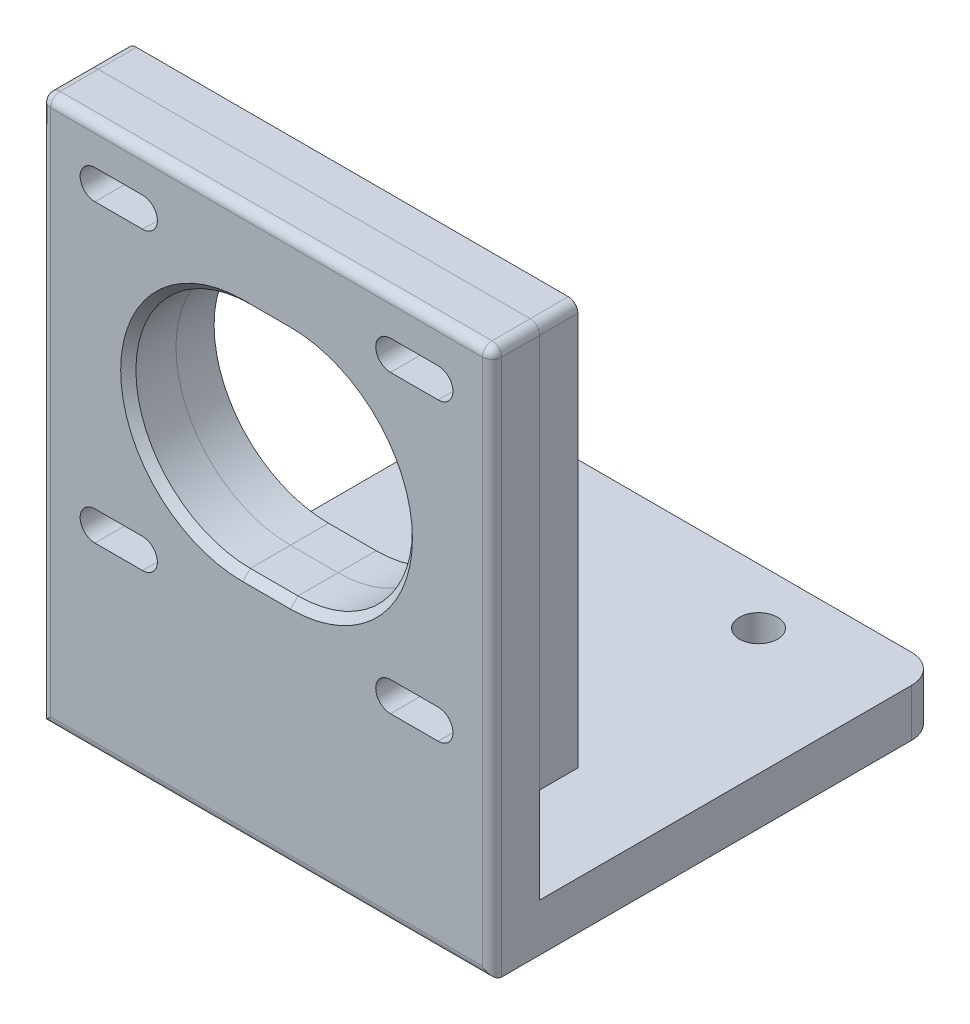
from build123d import *

# Parameters (mm, degrees)
BOSS_EXTRUDE2_DEPTH = 47.3
CUT_EXTRUDE1_REACH  = 89.918
FILLET1_R           = 1
CHAMFER1_SIZE       = 0.8
FILLET2_R           = 3
CUT_EXTRUDE2_REACH  = 84.077
SKETCH4_R           = 2
BOSS_EXTRUDE3_DEPTH = 4


with BuildPart() as part:
    # Sketch2 → Boss-Extrude2 (new body)
    with BuildSketch(Plane(origin=(0, 0, 0), x_dir=(0, 0, -1), z_dir=(1, 0, 0))):
        Polygon((0, 0), (0, -47.3), (0, -52.3), (42, -52.3), (42, -57.3), (-5, -57.3), (-5, 0), align=None)
    extrude(amount=BOSS_EXTRUDE2_DEPTH)

    # Sketch3 → Cut-Extrude1 (cut, up to next)
    with BuildSketch(Plane.XY.offset(5), mode=Mode.PRIVATE) as cut_extrude1_sk1:
        with BuildLine():
            Line((21.15, -9.15), (26.15, -9.15))
            ThreePointArc((26.15, -9.15), (38.15, -21.15), (26.15, -33.15))
            Line((26.15, -33.15), (21.15, -33.15))
            ThreePointArc((21.15, -33.15), (9.15, -21.15), (21.15, -9.15))
        make_face()
    cut_extrude1_tool1 = extrude(cut_extrude1_sk1.sketch, amount=-CUT_EXTRUDE1_REACH, mode=Mode.PRIVATE) & part.part
    # Sketch3 → Cut-Extrude1 (cut, up to next)
    with BuildSketch(Plane.XY.offset(5), mode=Mode.PRIVATE) as cut_extrude1_sk2:
        with BuildLine():
            Line((5.65, -35.1), (10.65, -35.1))
            ThreePointArc((10.65, -35.1), (12.2, -36.65), (10.65, -38.2))
            Line((10.65, -38.2), (5.65, -38.2))
            ThreePointArc((5.65, -38.2), (4.1, -36.65), (5.65, -35.1))
        make_face()
    cut_extrude1_tool2 = extrude(cut_extrude1_sk2.sketch, amount=-CUT_EXTRUDE1_REACH, mode=Mode.PRIVATE) & part.part
    # Sketch3 → Cut-Extrude1 (cut, up to next)
    with BuildSketch(Plane.XY.offset(5), mode=Mode.PRIVATE) as cut_extrude1_sk3:
        with BuildLine():
            Line((5.65, -7.2), (10.65, -7.2))
            ThreePointArc((10.65, -7.2), (12.2, -5.65), (10.65, -4.1))
            Line((10.65, -4.1), (5.65, -4.1))
            ThreePointArc((5.65, -4.1), (4.1, -5.65), (5.65, -7.2))
        make_face()
    cut_extrude1_tool3 = extrude(cut_extrude1_sk3.sketch, amount=-CUT_EXTRUDE1_REACH, mode=Mode.PRIVATE) & part.part
    # Sketch3 → Cut-Extrude1 (cut, up to next)
    with BuildSketch(Plane.XY.offset(5), mode=Mode.PRIVATE) as cut_extrude1_sk4:
        with BuildLine():
            Line((36.65, -7.2), (41.65, -7.2))
            ThreePointArc((41.65, -7.2), (43.2, -5.65), (41.65, -4.1))
            Line((41.65, -4.1), (36.65, -4.1))
            ThreePointArc((36.65, -4.1), (35.1, -5.65), (36.65, -7.2))
        make_face()
    cut_extrude1_tool4 = extrude(cut_extrude1_sk4.sketch, amount=-CUT_EXTRUDE1_REACH, mode=Mode.PRIVATE) & part.part
    # Sketch3 → Cut-Extrude1 (cut, up to next)
    with BuildSketch(Plane.XY.offset(5), mode=Mode.PRIVATE) as cut_extrude1_sk5:
        with BuildLine():
            Line((36.65, -38.2), (41.65, -38.2))
            ThreePointArc((41.65, -38.2), (43.2, -36.65), (41.65, -35.1))
            Line((41.65, -35.1), (36.65, -35.1))
            ThreePointArc((36.65, -35.1), (35.1, -36.65), (36.65, -38.2))
        make_face()
    cut_extrude1_tool5 = extrude(cut_extrude1_sk5.sketch, amount=-CUT_EXTRUDE1_REACH, mode=Mode.PRIVATE) & part.part
    add(cut_extrude1_tool1.solids().sort_by_distance((23.65, -21.15, 5))[0], mode=Mode.SUBTRACT)
    add(cut_extrude1_tool2.solids().sort_by_distance((8.15, -36.65, 5))[0], mode=Mode.SUBTRACT)
    add(cut_extrude1_tool3.solids().sort_by_distance((8.15, -5.65, 5))[0], mode=Mode.SUBTRACT)
    add(cut_extrude1_tool4.solids().sort_by_distance((39.15, -5.65, 5))[0], mode=Mode.SUBTRACT)
    add(cut_extrude1_tool5.solids().sort_by_distance((39.15, -36.65, 5))[0], mode=Mode.SUBTRACT)

    # Fillet1
    fillet1_edges = [part.edges().sort_by_distance(p)[0] for p in [
        (0, 0, 2.5),
        (23.65, -57.3, 5),
        (23.65, 0, 5),
        (47.3, 0, 2.5),
        (47.3, -28.65, 5),
        (0, -28.65, 5),
    ]]
    fillet(fillet1_edges, radius=FILLET1_R)

    # Chamfer1
    chamfer1_edges = [part.edges().sort_by_distance(p)[0] for p in [
        (9.15, -21.15, 5),
        (23.65, -33.15, 5),
        (38.15, -21.15, 5),
        (23.65, -9.15, 5),
    ]]
    chamfer(chamfer1_edges, length=CHAMFER1_SIZE)

    # Fillet2
    fillet2_edges = [part.edges().sort_by_distance(p)[0] for p in [
        (47.3, -54.8, -42),
        (0, -54.8, -42),
    ]]
    fillet(fillet2_edges, radius=FILLET2_R)

    # Sketch4 → Cut-Extrude2 (cut, up to next)
    with BuildSketch(Plane(origin=(0, -52.3, 0), x_dir=(1, 0, 0), z_dir=(0, 1, 0)), mode=Mode.PRIVATE) as cut_extrude2_sk1:
        with Locations(Location((9.65, 5, 0), (0, 0, 270))):
            Circle(SKETCH4_R)
    cut_extrude2_tool1 = extrude(cut_extrude2_sk1.sketch, amount=-CUT_EXTRUDE2_REACH, mode=Mode.PRIVATE) & part.part
    # Sketch4 → Cut-Extrude2 (cut, up to next)
    with BuildSketch(Plane(origin=(0, -52.3, 0), x_dir=(1, 0, 0), z_dir=(0, 1, 0)), mode=Mode.PRIVATE) as cut_extrude2_sk2:
        with Locations(Location((34.083374087, 36.161037061, 0), (0, 0, 270))):
            Circle(SKETCH4_R)
    cut_extrude2_tool2 = extrude(cut_extrude2_sk2.sketch, amount=-CUT_EXTRUDE2_REACH, mode=Mode.PRIVATE) & part.part
    add(cut_extrude2_tool1.solids().sort_by_distance((9.65, -52.3, -5))[0], mode=Mode.SUBTRACT)
    add(cut_extrude2_tool2.solids().sort_by_distance((34.083374, -52.3, -36.161037))[0], mode=Mode.SUBTRACT)


with BuildPart() as body_2:
    # Sketch5 → Boss-Extrude3 (new body)
    with BuildSketch(Plane(origin=(0, 0, 0), x_dir=(-1, 0, 0), z_dir=(0, 0, -1))):
        with BuildLine():
            Line((-46.3, 0), (-1, 0))
            ThreePointArc((-1, 0), (-0.292893219, -0.292893219), (0, -1))
            Line((0, -1), (0, -42.3))
            Line((0, -42.3), (-47.3, -42.3))
            Line((-47.3, -42.3), (-47.3, -1))
            ThreePointArc((-47.3, -1), (-47.007106781, -0.292893219), (-46.3, 0))
        make_face()
        with BuildLine():
            Line((-21.15, -9.15), (-26.15, -9.15))
            ThreePointArc((-26.15, -9.15), (-38.15, -21.15), (-26.15, -33.15))
            Line((-26.15, -33.15), (-21.15, -33.15))
            ThreePointArc((-21.15, -33.15), (-9.15, -21.15), (-21.15, -9.15))
        make_face(mode=Mode.SUBTRACT)
        with BuildLine():
            Line((-41.65, -7.2), (-36.65, -7.2))
            ThreePointArc((-36.65, -7.2), (-35.1, -5.65), (-36.65, -4.1))
            Line((-36.65, -4.1), (-41.65, -4.1))
            ThreePointArc((-41.65, -4.1), (-43.2, -5.65), (-41.65, -7.2))
        make_face(mode=Mode.SUBTRACT)
        with BuildLine():
            Line((-41.65, -38.2), (-36.65, -38.2))
            ThreePointArc((-36.65, -38.2), (-35.1, -36.65), (-36.65, -35.1))
            Line((-36.65, -35.1), (-41.65, -35.1))
            ThreePointArc((-41.65, -35.1), (-43.2, -36.65), (-41.65, -38.2))
        make_face(mode=Mode.SUBTRACT)
        with BuildLine():
            Line((-10.65, -38.2), (-5.65, -38.2))
            ThreePointArc((-5.65, -38.2), (-4.1, -36.65), (-5.65, -35.1))
            Line((-5.65, -35.1), (-10.65, -35.1))
            ThreePointArc((-10.65, -35.1), (-12.2, -36.65), (-10.65, -38.2))
        make_face(mode=Mode.SUBTRACT)
        with BuildLine():
            Line((-5.65, -4.1), (-10.65, -4.1))
            ThreePointArc((-10.65, -4.1), (-12.2, -5.65), (-10.65, -7.2))
            Line((-10.65, -7.2), (-5.65, -7.2))
            ThreePointArc((-5.65, -7.2), (-4.1, -5.65), (-5.65, -4.1))
        make_face(mode=Mode.SUBTRACT)
    extrude(amount=BOSS_EXTRUDE3_DEPTH)


solid = Compound([part.part, body_2.part])
